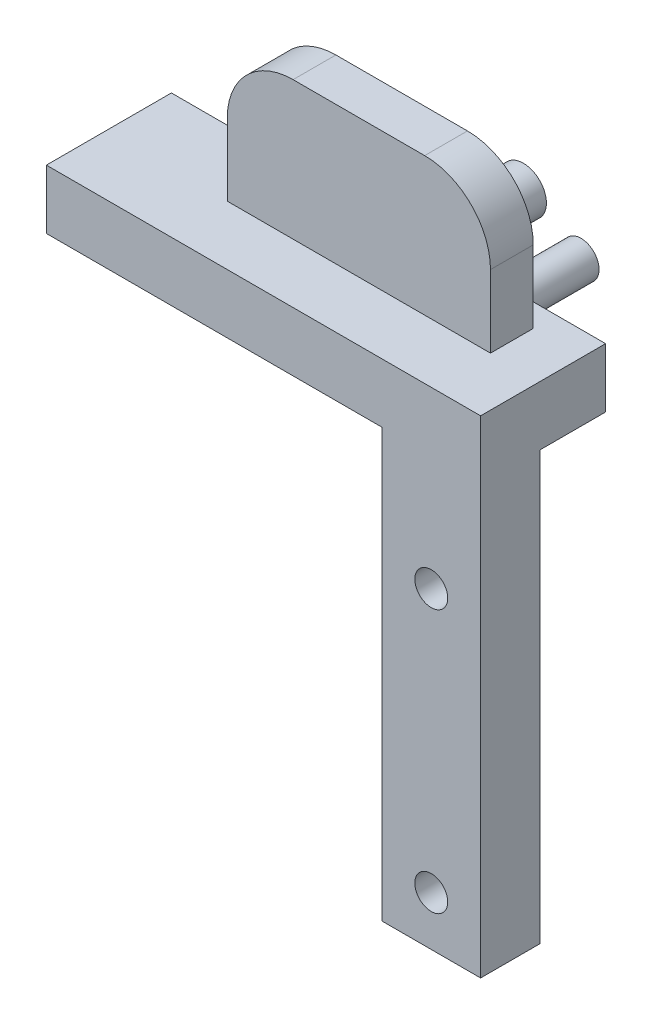
from build123d import *

# Parameters (mm, degrees)
BOSS_EXTRUDE2_DEPTH      = 8
BOSS_EXTRUDE2_DEPTH_BACK = 1
SKETCH1_W                = 66
SKETCH1_H                = 19
SKETCH3_R                = 2.75
BOSS_EXTRUDE3_DEPTH      = 13.75
SKETCH4_W                = 4.5
SKETCH4_H                = 6.5
BOSS_EXTRUDE4_DEPTH      = 15
BOSS_EXTRUDE5_DEPTH      = 8.5
SKETCH8_W                = 9
SKETCH8_H                = 6.5
BOSS_EXTRUDE6_DEPTH      = 6
SKETCH9_W                = 15.5
SKETCH9_H                = 6.5
BOSS_EXTRUDE7_DEPTH      = 21
BOSS_EXTRUDE8_DEPTH      = 8.5
CUT_EXTRUDE2_START       = -8.5
SKETCH12_R               = 3.5
CUT_EXTRUDE2_DEPTH       = 8.5
FILLET1_R                = 10
SKETCH14_W               = 15
SKETCH14_H               = 9
BOSS_EXTRUDE10_DEPTH     = 65
CUT_EXTRUDE3_REACH       = 91.135
SKETCH15_R               = 2.5


with BuildPart() as part:
    # Sketch1 → Boss-Extrude2 (new, two sides: drawn at the far end of the back side and taken through both)
    with BuildSketch(Plane(origin=(0, 0, 0), x_dir=(1, 0, 0), z_dir=(0, 1, 0)).offset(-BOSS_EXTRUDE2_DEPTH_BACK)):
        with Locations((22, 18)):
            Rectangle(SKETCH1_W, SKETCH1_H)
    extrude(amount=BOSS_EXTRUDE2_DEPTH + BOSS_EXTRUDE2_DEPTH_BACK)

    # Sketch3 → Boss-Extrude3 (add)
    with BuildSketch(Plane(origin=(0, 0, -27.5), x_dir=(-1, 0, 0), z_dir=(0, 0, -1))):
        with Locations((-37.5, 3.5)):
            Circle(SKETCH3_R)
        with Locations((-17.5, 3.5)):
            Circle(SKETCH3_R)
    extrude(amount=BOSS_EXTRUDE3_DEPTH)

    # Sketch4 → Boss-Extrude4 (add)
    with BuildSketch(Plane(origin=(0, 8, 0), x_dir=(1, 0, 0), z_dir=(0, 1, 0))):
        with Locations((25.25, 20.75)):
            Rectangle(SKETCH4_W, SKETCH4_H)
        with Locations((29.75, 20.75)):
            Rectangle(SKETCH4_W, SKETCH4_H)
    extrude(amount=BOSS_EXTRUDE4_DEPTH)

    # Sketch5 → Boss-Extrude5 (add)
    with BuildSketch(Plane(origin=(0, 0, -24), x_dir=(-1, 0, 0), z_dir=(0, 0, -1))):
        with BuildLine():
            ThreePointArc((-25.636419782, 13.037388184), (-24.436298745, 14.307742745), (-24, 16))
            ThreePointArc((-24, 16), (-29.974873734, 18.474873734), (-27.5, 12.5))
            ThreePointArc((-27.5, 12.5), (-26.685966178, 12.595980474), (-25.916578842, 12.878657751))
            ThreePointArc((-25.916578842, 12.878657751), (-25.85405917, 13.094916041), (-25.636419782, 13.037388184))
        make_face()
    extrude(amount=BOSS_EXTRUDE5_DEPTH)

    # Sketch8 → Boss-Extrude6 (add)
    with BuildSketch(Plane(origin=(0, 23, 0), x_dir=(1, 0, 0), z_dir=(0, 1, 0))):
        with Locations((27.5, 20.75)):
            Rectangle(SKETCH8_W, SKETCH8_H)
    extrude(amount=BOSS_EXTRUDE6_DEPTH)

    # Sketch9 → Boss-Extrude7 (add)
    with BuildSketch(Plane(origin=(0, 8, 0), x_dir=(1, 0, 0), z_dir=(0, 1, 0))):
        with Locations((15.25, 20.75)):
            Rectangle(SKETCH9_W, SKETCH9_H)
        with Locations((39.75, 20.75)):
            Rectangle(SKETCH9_W, SKETCH9_H)
    extrude(amount=BOSS_EXTRUDE7_DEPTH)

    # Sketch10 → Boss-Extrude8 (add)
    with BuildSketch(Plane(origin=(0, 0, -24), x_dir=(-1, 0, 0), z_dir=(0, 0, -1))):
        with BuildLine():
            Line((-21, 17), (-17.5, 17))
            Line((-17.5, 17), (-14, 17))
            ThreePointArc((-14, 17), (-17.5, 20.5), (-21, 17))
        make_face()
        with BuildLine():
            Line((-17.5, 13.5), (-17.5, 17))
            Line((-17.5, 17), (-21, 17))
            ThreePointArc((-21, 17), (-19.974873734, 14.525126266), (-17.5, 13.5))
        make_face()
        with BuildLine():
            Line((-14, 17), (-17.5, 17))
            Line((-17.5, 17), (-17.5, 13.5))
            ThreePointArc((-17.5, 13.5), (-15.025126266, 14.525126266), (-14, 17))
        make_face()
        with BuildLine():
            Line((-37.5, 17), (-34, 17))
            ThreePointArc((-34, 17), (-37.5, 20.5), (-41, 17))
            Line((-41, 17), (-37.5, 17))
        make_face()
        with BuildLine():
            ThreePointArc((-37.5, 13.5), (-35.025126266, 14.525126266), (-34, 17))
            Line((-34, 17), (-37.5, 17))
            Line((-37.5, 17), (-37.5, 13.5))
        make_face()
        with BuildLine():
            Line((-37.5, 13.5), (-37.5, 17))
            Line((-37.5, 17), (-41, 17))
            ThreePointArc((-41, 17), (-39.974873734, 14.525126266), (-37.5, 13.5))
        make_face()
    extrude(amount=BOSS_EXTRUDE8_DEPTH)

    # Sketch12 → Cut-Extrude2 (cut)
    with BuildSketch(Plane(origin=(0, 0, -32.5), x_dir=(-1, 0, 0), z_dir=(0, 0, -1)).offset(CUT_EXTRUDE2_START)):
        with Locations((-27.5, 16)):
            Circle(SKETCH12_R)
    extrude(amount=CUT_EXTRUDE2_DEPTH, mode=Mode.SUBTRACT)

    # Fillet1
    fillet1_edges = [part.edges().sort_by_distance(p)[0] for p in [
        (7.5, 29, -20.75),
        (47.5, 29, -20.75),
    ]]
    fillet(fillet1_edges, radius=FILLET1_R)

    # Sketch14 → Boss-Extrude10 (add)
    with BuildSketch(Plane.XZ.offset(1)):
        with Locations((47.5, -13)):
            Rectangle(SKETCH14_W, SKETCH14_H)
    extrude(amount=BOSS_EXTRUDE10_DEPTH)

    # Sketch15 → Cut-Extrude3 (cut, up to next)
    with BuildSketch(Plane(origin=(0, 0, -17.5), x_dir=(-1, 0, 0), z_dir=(0, 0, -1)), mode=Mode.PRIVATE) as cut_extrude3_sk1:
        with Locations((-47.5, -58.5)):
            Circle(SKETCH15_R)
    cut_extrude3_tool1 = extrude(cut_extrude3_sk1.sketch, amount=-CUT_EXTRUDE3_REACH, mode=Mode.PRIVATE) & part.part
    # Sketch15 → Cut-Extrude3 (cut, up to next)
    with BuildSketch(Plane(origin=(0, 0, -17.5), x_dir=(-1, 0, 0), z_dir=(0, 0, -1)), mode=Mode.PRIVATE) as cut_extrude3_sk2:
        with Locations((-47.5, -18.5)):
            Circle(SKETCH15_R)
    cut_extrude3_tool2 = extrude(cut_extrude3_sk2.sketch, amount=-CUT_EXTRUDE3_REACH, mode=Mode.PRIVATE) & part.part
    add(cut_extrude3_tool1.solids().sort_by_distance((47.5, -58.5, -17.5))[0], mode=Mode.SUBTRACT)
    add(cut_extrude3_tool2.solids().sort_by_distance((47.5, -18.5, -17.5))[0], mode=Mode.SUBTRACT)


solid = part.part
